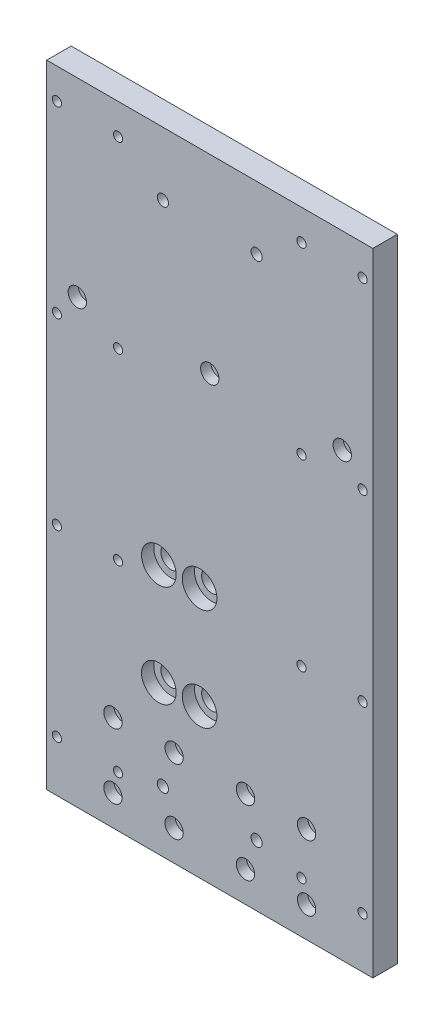
from build123d import *

# Parameters (mm, degrees)
ESQUISSE1_W             = 160
ESQUISSE1_H             = 310
ESQUISSE1_R             = 2.5
ESQUISSE1_R_2           = 2.75
ESQUISSE1_R_3           = 2.25
BOSS_EXTRU_1_DEPTH      = 12
ESQUISSE2_R             = 4.5
ENL_V_MAT_EXTRU_1_DEPTH = 5
ENL_V_MAT_EXTRU_2_REACH = 351.062
ESQUISSE3_R             = 2.25
ENL_V_MAT_EXTRU_3_REACH = 351.062
ESQUISSE4_R             = 5
ESQUISSE5_R             = 8.5
ENL_V_MAT_EXTRU_4_DEPTH = 6


with BuildPart() as part:
    # Esquisse1 → Boss.-Extru.1 (new body)
    with BuildSketch(Plane.XY):
        with Locations((80, 155)):
            Rectangle(ESQUISSE1_W, ESQUISSE1_H)
        with Locations((97.5, 15)):
            Circle(ESQUISSE1_R, mode=Mode.SUBTRACT)
        with Locations((127.5, 15)):
            Circle(ESQUISSE1_R, mode=Mode.SUBTRACT)
        with Locations((97.5, 47)):
            Circle(ESQUISSE1_R, mode=Mode.SUBTRACT)
        with Locations((127.5, 47)):
            Circle(ESQUISSE1_R, mode=Mode.SUBTRACT)
        with Locations(Location((62.5, 47, 0), (0, 0, 180))):
            Circle(ESQUISSE1_R, mode=Mode.SUBTRACT)
        with Locations(Location((32.5, 47, 0), (0, 0, 180))):
            Circle(ESQUISSE1_R, mode=Mode.SUBTRACT)
        with Locations(Location((32.5, 15, 0), (0, 0, 180))):
            Circle(ESQUISSE1_R, mode=Mode.SUBTRACT)
        with Locations(Location((62.5, 15, 0), (0, 0, 180))):
            Circle(ESQUISSE1_R, mode=Mode.SUBTRACT)
        with Locations((57, 30)):
            Circle(ESQUISSE1_R_2, mode=Mode.SUBTRACT)
        with Locations(Location((103, 30, 0), (0, 0, 180))):
            Circle(ESQUISSE1_R_2, mode=Mode.SUBTRACT)
        with Locations((57, 279)):
            Circle(ESQUISSE1_R_2, mode=Mode.SUBTRACT)
        with Locations(Location((103, 279, 0), (0, 0, 180))):
            Circle(ESQUISSE1_R_2, mode=Mode.SUBTRACT)
        with Locations((15, 216.85)):
            Circle(ESQUISSE1_R_3, mode=Mode.SUBTRACT)
        with Locations((80, 216.85)):
            Circle(ESQUISSE1_R_3, mode=Mode.SUBTRACT)
        with Locations((145, 216.85)):
            Circle(ESQUISSE1_R_3, mode=Mode.SUBTRACT)
    extrude(amount=BOSS_EXTRU_1_DEPTH)

    # Esquisse2 → Enlèv. mat.-Extru.1 (cut)
    with BuildSketch(Plane.XY.offset(12)):
        with Locations((32.5, 47)):
            Circle(ESQUISSE2_R)
        with Locations((32.5, 15)):
            Circle(ESQUISSE2_R)
        with Locations((62.5, 15)):
            Circle(ESQUISSE2_R)
        with Locations((62.5, 47)):
            Circle(ESQUISSE2_R)
        with Locations(Location((127.5, 15, 0), (0, 0, 180))):
            Circle(ESQUISSE2_R)
        with Locations(Location((97.5, 15, 0), (0, 0, 180))):
            Circle(ESQUISSE2_R)
        with Locations(Location((97.5, 47, 0), (0, 0, 180))):
            Circle(ESQUISSE2_R)
        with Locations(Location((127.5, 47, 0), (0, 0, 180))):
            Circle(ESQUISSE2_R)
        with Locations((15, 216.85)):
            Circle(ESQUISSE2_R)
        with Locations((80, 216.85)):
            Circle(ESQUISSE2_R)
        with Locations((145, 216.85)):
            Circle(ESQUISSE2_R)
    extrude(amount=-ENL_V_MAT_EXTRU_1_DEPTH, mode=Mode.SUBTRACT)

    # Esquisse3 → Enlèv. mat.-Extru.2 (cut, up to next)
    with BuildSketch(Plane.XY.offset(12), mode=Mode.PRIVATE) as enl_v_mat_extru_2_sk1:
        with Locations((155, 25)):
            Circle(ESQUISSE3_R)
    enl_v_mat_extru_2_tool1 = extrude(enl_v_mat_extru_2_sk1.sketch, amount=-ENL_V_MAT_EXTRU_2_REACH, mode=Mode.PRIVATE) & part.part
    # Esquisse3 → Enlèv. mat.-Extru.2 (cut, up to next)
    with BuildSketch(Plane.XY.offset(12), mode=Mode.PRIVATE) as enl_v_mat_extru_2_sk2:
        with Locations((125, 25)):
            Circle(ESQUISSE3_R)
    enl_v_mat_extru_2_tool2 = extrude(enl_v_mat_extru_2_sk2.sketch, amount=-ENL_V_MAT_EXTRU_2_REACH, mode=Mode.PRIVATE) & part.part
    # Esquisse3 → Enlèv. mat.-Extru.2 (cut, up to next)
    with BuildSketch(Plane.XY.offset(12), mode=Mode.PRIVATE) as enl_v_mat_extru_2_sk3:
        with Locations((125, 115)):
            Circle(ESQUISSE3_R)
    enl_v_mat_extru_2_tool3 = extrude(enl_v_mat_extru_2_sk3.sketch, amount=-ENL_V_MAT_EXTRU_2_REACH, mode=Mode.PRIVATE) & part.part
    # Esquisse3 → Enlèv. mat.-Extru.2 (cut, up to next)
    with BuildSketch(Plane.XY.offset(12), mode=Mode.PRIVATE) as enl_v_mat_extru_2_sk4:
        with Locations((125, 205)):
            Circle(ESQUISSE3_R)
    enl_v_mat_extru_2_tool4 = extrude(enl_v_mat_extru_2_sk4.sketch, amount=-ENL_V_MAT_EXTRU_2_REACH, mode=Mode.PRIVATE) & part.part
    # Esquisse3 → Enlèv. mat.-Extru.2 (cut, up to next)
    with BuildSketch(Plane.XY.offset(12), mode=Mode.PRIVATE) as enl_v_mat_extru_2_sk5:
        with Locations((125, 295)):
            Circle(ESQUISSE3_R)
    enl_v_mat_extru_2_tool5 = extrude(enl_v_mat_extru_2_sk5.sketch, amount=-ENL_V_MAT_EXTRU_2_REACH, mode=Mode.PRIVATE) & part.part
    # Esquisse3 → Enlèv. mat.-Extru.2 (cut, up to next)
    with BuildSketch(Plane.XY.offset(12), mode=Mode.PRIVATE) as enl_v_mat_extru_2_sk6:
        with Locations((155, 115)):
            Circle(ESQUISSE3_R)
    enl_v_mat_extru_2_tool6 = extrude(enl_v_mat_extru_2_sk6.sketch, amount=-ENL_V_MAT_EXTRU_2_REACH, mode=Mode.PRIVATE) & part.part
    # Esquisse3 → Enlèv. mat.-Extru.2 (cut, up to next)
    with BuildSketch(Plane.XY.offset(12), mode=Mode.PRIVATE) as enl_v_mat_extru_2_sk7:
        with Locations((155, 205)):
            Circle(ESQUISSE3_R)
    enl_v_mat_extru_2_tool7 = extrude(enl_v_mat_extru_2_sk7.sketch, amount=-ENL_V_MAT_EXTRU_2_REACH, mode=Mode.PRIVATE) & part.part
    # Esquisse3 → Enlèv. mat.-Extru.2 (cut, up to next)
    with BuildSketch(Plane.XY.offset(12), mode=Mode.PRIVATE) as enl_v_mat_extru_2_sk8:
        with Locations((155, 295)):
            Circle(ESQUISSE3_R)
    enl_v_mat_extru_2_tool8 = extrude(enl_v_mat_extru_2_sk8.sketch, amount=-ENL_V_MAT_EXTRU_2_REACH, mode=Mode.PRIVATE) & part.part
    # Esquisse3 → Enlèv. mat.-Extru.2 (cut, up to next)
    with BuildSketch(Plane.XY.offset(12), mode=Mode.PRIVATE) as enl_v_mat_extru_2_sk9:
        with Locations(Location((5, 295, 0), (0, 0, 180))):
            Circle(ESQUISSE3_R)
    enl_v_mat_extru_2_tool9 = extrude(enl_v_mat_extru_2_sk9.sketch, amount=-ENL_V_MAT_EXTRU_2_REACH, mode=Mode.PRIVATE) & part.part
    # Esquisse3 → Enlèv. mat.-Extru.2 (cut, up to next)
    with BuildSketch(Plane.XY.offset(12), mode=Mode.PRIVATE) as enl_v_mat_extru_2_sk10:
        with Locations(Location((35, 295, 0), (0, 0, 180))):
            Circle(ESQUISSE3_R)
    enl_v_mat_extru_2_tool10 = extrude(enl_v_mat_extru_2_sk10.sketch, amount=-ENL_V_MAT_EXTRU_2_REACH, mode=Mode.PRIVATE) & part.part
    # Esquisse3 → Enlèv. mat.-Extru.2 (cut, up to next)
    with BuildSketch(Plane.XY.offset(12), mode=Mode.PRIVATE) as enl_v_mat_extru_2_sk11:
        with Locations(Location((5, 205, 0), (0, 0, 180))):
            Circle(ESQUISSE3_R)
    enl_v_mat_extru_2_tool11 = extrude(enl_v_mat_extru_2_sk11.sketch, amount=-ENL_V_MAT_EXTRU_2_REACH, mode=Mode.PRIVATE) & part.part
    # Esquisse3 → Enlèv. mat.-Extru.2 (cut, up to next)
    with BuildSketch(Plane.XY.offset(12), mode=Mode.PRIVATE) as enl_v_mat_extru_2_sk12:
        with Locations(Location((35, 205, 0), (0, 0, 180))):
            Circle(ESQUISSE3_R)
    enl_v_mat_extru_2_tool12 = extrude(enl_v_mat_extru_2_sk12.sketch, amount=-ENL_V_MAT_EXTRU_2_REACH, mode=Mode.PRIVATE) & part.part
    # Esquisse3 → Enlèv. mat.-Extru.2 (cut, up to next)
    with BuildSketch(Plane.XY.offset(12), mode=Mode.PRIVATE) as enl_v_mat_extru_2_sk13:
        with Locations(Location((35, 115, 0), (0, 0, 180))):
            Circle(ESQUISSE3_R)
    enl_v_mat_extru_2_tool13 = extrude(enl_v_mat_extru_2_sk13.sketch, amount=-ENL_V_MAT_EXTRU_2_REACH, mode=Mode.PRIVATE) & part.part
    # Esquisse3 → Enlèv. mat.-Extru.2 (cut, up to next)
    with BuildSketch(Plane.XY.offset(12), mode=Mode.PRIVATE) as enl_v_mat_extru_2_sk14:
        with Locations(Location((5, 115, 0), (0, 0, 180))):
            Circle(ESQUISSE3_R)
    enl_v_mat_extru_2_tool14 = extrude(enl_v_mat_extru_2_sk14.sketch, amount=-ENL_V_MAT_EXTRU_2_REACH, mode=Mode.PRIVATE) & part.part
    # Esquisse3 → Enlèv. mat.-Extru.2 (cut, up to next)
    with BuildSketch(Plane.XY.offset(12), mode=Mode.PRIVATE) as enl_v_mat_extru_2_sk15:
        with Locations(Location((35, 25, 0), (0, 0, 180))):
            Circle(ESQUISSE3_R)
    enl_v_mat_extru_2_tool15 = extrude(enl_v_mat_extru_2_sk15.sketch, amount=-ENL_V_MAT_EXTRU_2_REACH, mode=Mode.PRIVATE) & part.part
    # Esquisse3 → Enlèv. mat.-Extru.2 (cut, up to next)
    with BuildSketch(Plane.XY.offset(12), mode=Mode.PRIVATE) as enl_v_mat_extru_2_sk16:
        with Locations(Location((5, 25, 0), (0, 0, 180))):
            Circle(ESQUISSE3_R)
    enl_v_mat_extru_2_tool16 = extrude(enl_v_mat_extru_2_sk16.sketch, amount=-ENL_V_MAT_EXTRU_2_REACH, mode=Mode.PRIVATE) & part.part
    add(enl_v_mat_extru_2_tool1.solids().sort_by_distance((155, 25, 12))[0], mode=Mode.SUBTRACT)
    add(enl_v_mat_extru_2_tool2.solids().sort_by_distance((125, 25, 12))[0], mode=Mode.SUBTRACT)
    add(enl_v_mat_extru_2_tool3.solids().sort_by_distance((125, 115, 12))[0], mode=Mode.SUBTRACT)
    add(enl_v_mat_extru_2_tool4.solids().sort_by_distance((125, 205, 12))[0], mode=Mode.SUBTRACT)
    add(enl_v_mat_extru_2_tool5.solids().sort_by_distance((125, 295, 12))[0], mode=Mode.SUBTRACT)
    add(enl_v_mat_extru_2_tool6.solids().sort_by_distance((155, 115, 12))[0], mode=Mode.SUBTRACT)
    add(enl_v_mat_extru_2_tool7.solids().sort_by_distance((155, 205, 12))[0], mode=Mode.SUBTRACT)
    add(enl_v_mat_extru_2_tool8.solids().sort_by_distance((155, 295, 12))[0], mode=Mode.SUBTRACT)
    add(enl_v_mat_extru_2_tool9.solids().sort_by_distance((5, 295, 12))[0], mode=Mode.SUBTRACT)
    add(enl_v_mat_extru_2_tool10.solids().sort_by_distance((35, 295, 12))[0], mode=Mode.SUBTRACT)
    add(enl_v_mat_extru_2_tool11.solids().sort_by_distance((5, 205, 12))[0], mode=Mode.SUBTRACT)
    add(enl_v_mat_extru_2_tool12.solids().sort_by_distance((35, 205, 12))[0], mode=Mode.SUBTRACT)
    add(enl_v_mat_extru_2_tool13.solids().sort_by_distance((35, 115, 12))[0], mode=Mode.SUBTRACT)
    add(enl_v_mat_extru_2_tool14.solids().sort_by_distance((5, 115, 12))[0], mode=Mode.SUBTRACT)
    add(enl_v_mat_extru_2_tool15.solids().sort_by_distance((35, 25, 12))[0], mode=Mode.SUBTRACT)
    add(enl_v_mat_extru_2_tool16.solids().sort_by_distance((5, 25, 12))[0], mode=Mode.SUBTRACT)

    # Esquisse4 → Enlèv. mat.-Extru.3 (cut, up to next)
    with BuildSketch(Plane.XY.offset(12), mode=Mode.PRIVATE) as enl_v_mat_extru_3_sk1:
        with Locations((55, 73)):
            Circle(ESQUISSE4_R)
    enl_v_mat_extru_3_tool1 = extrude(enl_v_mat_extru_3_sk1.sketch, amount=-ENL_V_MAT_EXTRU_3_REACH, mode=Mode.PRIVATE) & part.part
    # Esquisse4 → Enlèv. mat.-Extru.3 (cut, up to next)
    with BuildSketch(Plane.XY.offset(12), mode=Mode.PRIVATE) as enl_v_mat_extru_3_sk2:
        with Locations((75, 73)):
            Circle(ESQUISSE4_R)
    enl_v_mat_extru_3_tool2 = extrude(enl_v_mat_extru_3_sk2.sketch, amount=-ENL_V_MAT_EXTRU_3_REACH, mode=Mode.PRIVATE) & part.part
    # Esquisse4 → Enlèv. mat.-Extru.3 (cut, up to next)
    with BuildSketch(Plane.XY.offset(12), mode=Mode.PRIVATE) as enl_v_mat_extru_3_sk3:
        with Locations((75, 123)):
            Circle(ESQUISSE4_R)
    enl_v_mat_extru_3_tool3 = extrude(enl_v_mat_extru_3_sk3.sketch, amount=-ENL_V_MAT_EXTRU_3_REACH, mode=Mode.PRIVATE) & part.part
    # Esquisse4 → Enlèv. mat.-Extru.3 (cut, up to next)
    with BuildSketch(Plane.XY.offset(12), mode=Mode.PRIVATE) as enl_v_mat_extru_3_sk4:
        with Locations((55, 123)):
            Circle(ESQUISSE4_R)
    enl_v_mat_extru_3_tool4 = extrude(enl_v_mat_extru_3_sk4.sketch, amount=-ENL_V_MAT_EXTRU_3_REACH, mode=Mode.PRIVATE) & part.part
    add(enl_v_mat_extru_3_tool1.solids().sort_by_distance((55, 73, 12))[0], mode=Mode.SUBTRACT)
    add(enl_v_mat_extru_3_tool2.solids().sort_by_distance((75, 73, 12))[0], mode=Mode.SUBTRACT)
    add(enl_v_mat_extru_3_tool3.solids().sort_by_distance((75, 123, 12))[0], mode=Mode.SUBTRACT)
    add(enl_v_mat_extru_3_tool4.solids().sort_by_distance((55, 123, 12))[0], mode=Mode.SUBTRACT)

    # Esquisse5 → Enlèv. mat.-Extru.4 (cut)
    with BuildSketch(Plane.XY.offset(12)):
        with Locations((55, 123)):
            Circle(ESQUISSE5_R)
        with Locations((75, 123)):
            Circle(ESQUISSE5_R)
        with Locations((75, 73)):
            Circle(ESQUISSE5_R)
        with Locations((55, 73)):
            Circle(ESQUISSE5_R)
    extrude(amount=-ENL_V_MAT_EXTRU_4_DEPTH, mode=Mode.SUBTRACT)


solid = part.part
